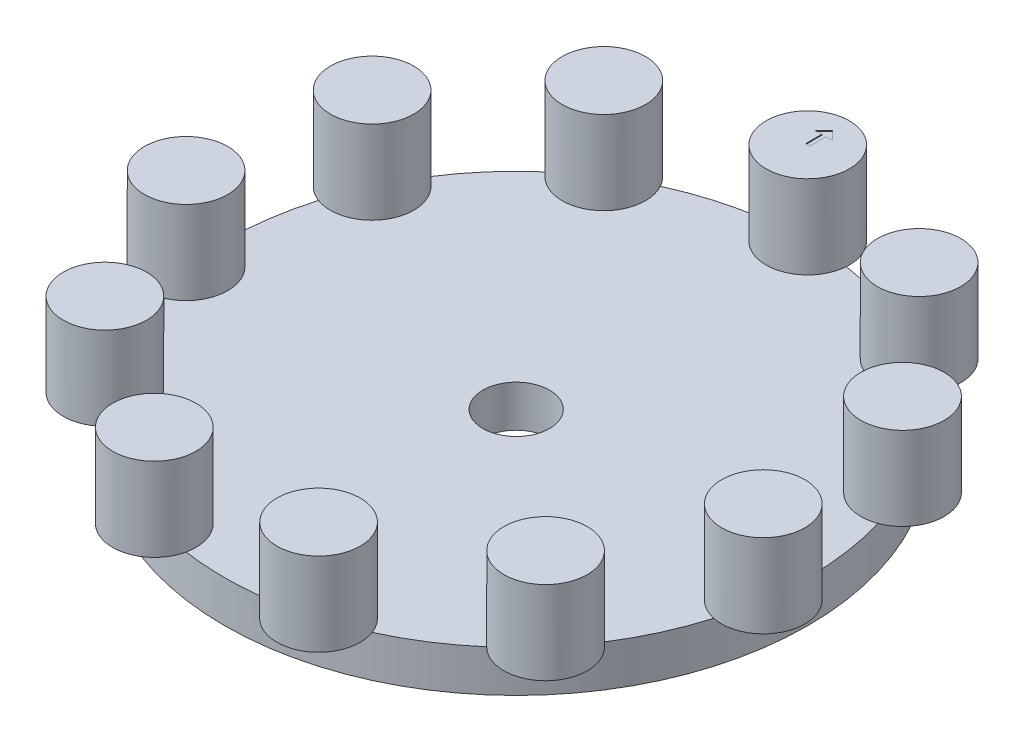
from build123d import *

# Parameters (mm, degrees)
SKETCH1_R              = 5
BOSS_EXTRUDE1_DEPTH    = 10
BOSS_EXTRUDE1_2_DEPTH  = 10
BOSS_EXTRUDE1_3_DEPTH  = 10
BOSS_EXTRUDE1_4_DEPTH  = 10
BOSS_EXTRUDE1_5_DEPTH  = 10
BOSS_EXTRUDE1_6_DEPTH  = 10
BOSS_EXTRUDE1_7_DEPTH  = 10
BOSS_EXTRUDE1_8_DEPTH  = 10
BOSS_EXTRUDE1_9_DEPTH  = 10
BOSS_EXTRUDE1_10_DEPTH = 10
BOSS_EXTRUDE1_11_DEPTH = 10
SKETCH2_R              = 35
SKETCH2_R_2            = 4
BOSS_EXTRUDE2_DEPTH    = 5
SKETCH3_W              = 0.25
SKETCH3_H              = 1.939339828
CUT_EXTRUDE1_DEPTH     = 0.1


with BuildPart() as part:
    # Sketch1 → Boss-Extrude1 (new body)
    with BuildSketch(Plane(origin=(0, 0, 0), x_dir=(1, 0, 0), z_dir=(0, 1, 0))):
        with Locations(Location((0, 35, 0), (0, 0, 270))):
            Circle(SKETCH1_R)
    extrude(amount=BOSS_EXTRUDE1_DEPTH)



with BuildPart() as body_2:
    # Sketch1 → Boss-Extrude1 2 (new body)
    with BuildSketch(Plane(origin=(0, 0, 0), x_dir=(1, 0, 0), z_dir=(0, 1, 0))):
        with Locations(Location((18.922428611, 29.443873649, 0), (0, 0, 270))):
            Circle(SKETCH1_R)
    extrude(amount=BOSS_EXTRUDE1_2_DEPTH)


with BuildPart() as body_3:
    # Sketch1 → Boss-Extrude1 3 (new body)
    with BuildSketch(Plane(origin=(0, 0, 0), x_dir=(1, 0, 0), z_dir=(0, 1, 0))):
        with Locations(Location((31.837119837, 14.539525455, 0), (0, 0, 270))):
            Circle(SKETCH1_R)
    extrude(amount=BOSS_EXTRUDE1_3_DEPTH)


with BuildPart() as body_4:
    # Sketch1 → Boss-Extrude1 4 (new body)
    with BuildSketch(Plane(origin=(0, 0, 0), x_dir=(1, 0, 0), z_dir=(0, 1, 0))):
        with Locations(Location((34.643750466, -4.98101934, 0), (0, 0, 270))):
            Circle(SKETCH1_R)
    extrude(amount=BOSS_EXTRUDE1_4_DEPTH)


with BuildPart() as body_5:
    # Sketch1 → Boss-Extrude1 5 (new body)
    with BuildSketch(Plane(origin=(0, 0, 0), x_dir=(1, 0, 0), z_dir=(0, 1, 0))):
        with Locations(Location((26.451235102, -22.920125688, 0), (0, 0, 270))):
            Circle(SKETCH1_R)
    extrude(amount=BOSS_EXTRUDE1_5_DEPTH)


with BuildPart() as body_6:
    # Sketch1 → Boss-Extrude1 6 (new body)
    with BuildSketch(Plane(origin=(0, 0, 0), x_dir=(1, 0, 0), z_dir=(0, 1, 0))):
        with Locations(Location((9.860639489, -33.582254077, 0), (0, 0, 270))):
            Circle(SKETCH1_R)
    extrude(amount=BOSS_EXTRUDE1_6_DEPTH)


with BuildPart() as body_7:
    # Sketch1 → Boss-Extrude1 7 (new body)
    with BuildSketch(Plane(origin=(0, 0, 0), x_dir=(1, 0, 0), z_dir=(0, 1, 0))):
        with Locations(Location((-9.860639489, -33.582254077, 0), (0, 0, 270))):
            Circle(SKETCH1_R)
    extrude(amount=BOSS_EXTRUDE1_7_DEPTH)


with BuildPart() as body_8:
    # Sketch1 → Boss-Extrude1 8 (new body)
    with BuildSketch(Plane(origin=(0, 0, 0), x_dir=(1, 0, 0), z_dir=(0, 1, 0))):
        with Locations(Location((-26.451235102, -22.920125688, 0), (0, 0, 270))):
            Circle(SKETCH1_R)
    extrude(amount=BOSS_EXTRUDE1_8_DEPTH)


with BuildPart() as body_9:
    # Sketch1 → Boss-Extrude1 9 (new body)
    with BuildSketch(Plane(origin=(0, 0, 0), x_dir=(1, 0, 0), z_dir=(0, 1, 0))):
        with Locations(Location((-34.643750466, -4.98101934, 0), (0, 0, 270))):
            Circle(SKETCH1_R)
    extrude(amount=BOSS_EXTRUDE1_9_DEPTH)


with BuildPart() as body_10:
    # Sketch1 → Boss-Extrude1 10 (new body)
    with BuildSketch(Plane(origin=(0, 0, 0), x_dir=(1, 0, 0), z_dir=(0, 1, 0))):
        with Locations(Location((-31.837119837, 14.539525455, 0), (0, 0, 270))):
            Circle(SKETCH1_R)
    extrude(amount=BOSS_EXTRUDE1_10_DEPTH)


with BuildPart() as body_11:
    # Sketch1 → Boss-Extrude1 11 (new body)
    with BuildSketch(Plane(origin=(0, 0, 0), x_dir=(1, 0, 0), z_dir=(0, 1, 0))):
        with Locations(Location((-18.922428611, 29.443873649, 0), (0, 0, 270))):
            Circle(SKETCH1_R)
    extrude(amount=BOSS_EXTRUDE1_11_DEPTH)


with BuildPart() as part_1:
    add(part.part)

    add(body_2.part)  # Boss-Extrude2 merges body 2

    add(body_3.part)  # Boss-Extrude2 merges body 3

    add(body_4.part)  # Boss-Extrude2 merges body 4

    add(body_5.part)  # Boss-Extrude2 merges body 5

    add(body_6.part)  # Boss-Extrude2 merges body 6

    add(body_7.part)  # Boss-Extrude2 merges body 7

    add(body_8.part)  # Boss-Extrude2 merges body 8

    add(body_9.part)  # Boss-Extrude2 merges body 9

    add(body_10.part)  # Boss-Extrude2 merges body 10

    add(body_11.part)  # Boss-Extrude2 merges body 11
    # Sketch2 → Boss-Extrude2 (add)
    with BuildSketch(Plane(origin=(0, 0, 0), x_dir=(1, 0, 0), z_dir=(0, 1, 0))):
        with Locations(Location((0, 0, 0), (0, 0, 270))):
            Circle(SKETCH2_R)
        with Locations(Location((0, 0, 0), (0, 0, 270))):
            Circle(SKETCH2_R_2, mode=Mode.SUBTRACT)
    extrude(amount=-BOSS_EXTRUDE2_DEPTH)

    # Sketch3 → Cut-Extrude1 (cut)
    with BuildSketch(Plane(origin=(0, 10, 0), x_dir=(1, 0, 0), z_dir=(0, 1, 0))):
        Polygon((-1.060660172, 36.939339828), (-0.25, 36.939339828), (-0.25, 37.75), align=None)
        Polygon((-0.25, 36.939339828), (0, 36.939339828), (0, 38), (-0.25, 37.75), align=None)
        Polygon((0, 38), (0, 36.939339828), (0.25, 36.939339828), (0.25, 37.75), align=None)
        Polygon((0.25, 37.75), (0.25, 36.939339828), (1.060660172, 36.939339828), align=None)
        with Locations((0.125, 35.969669914)):
            Rectangle(SKETCH3_W, SKETCH3_H)
        with Locations((-0.125, 35.969669914)):
            Rectangle(SKETCH3_W, SKETCH3_H)
    extrude(amount=-CUT_EXTRUDE1_DEPTH, mode=Mode.SUBTRACT)


solid = part_1.part
